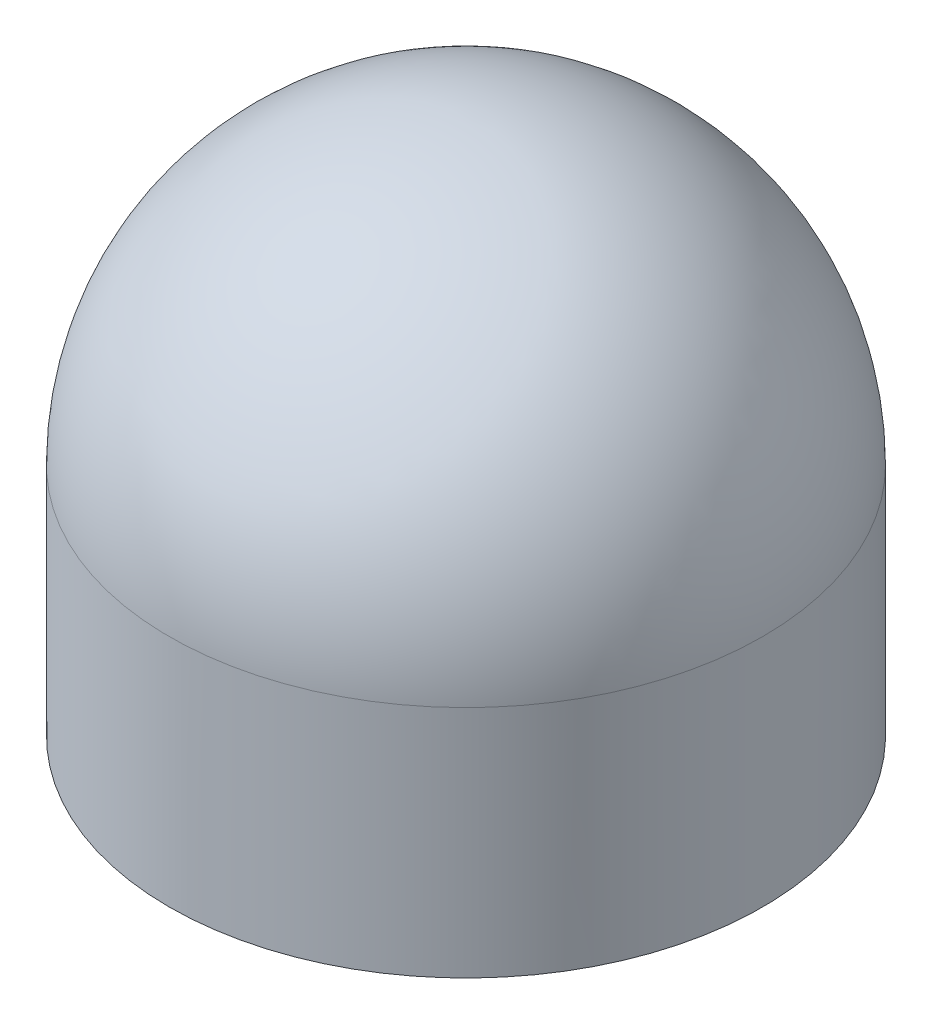
from build123d import *


with BuildPart() as part:
    # Sketch2 → Revolve1 (revolve)
    with BuildSketch(Plane.XY, mode=Mode.PRIVATE) as revolve1_sk:
        with BuildLine():
            Line((0, 7.62), (0, 17.272))
            ThreePointArc((0, 17.272), (6.824994652, 14.444994652), (9.652, 7.62))
            Line((9.652, 7.62), (9.652, 0))
            Line((9.652, 0), (0, 0))
            Line((0, 0), (0, 7.62))
        make_face()
    revolve(revolve1_sk.sketch.rotate(Axis((0, 7.62, 0), (0, 1, 0)), 90), axis=Axis((0, 7.62, 0), (0, 1, 0)))


solid = part.part
